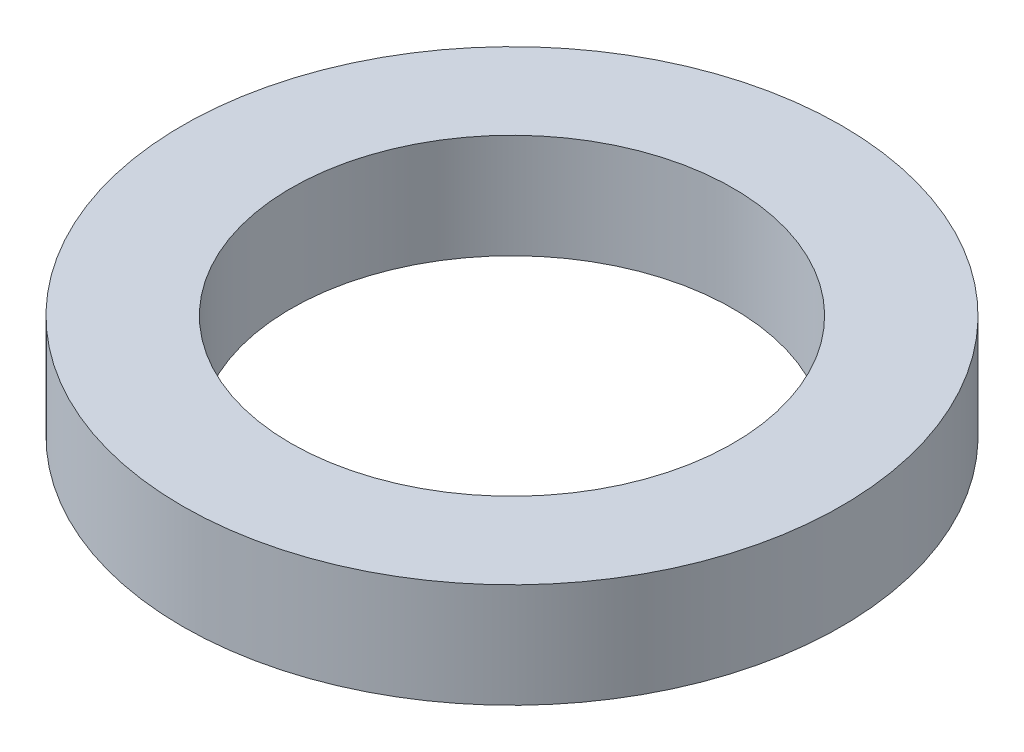
from build123d import *

# Parameters (mm, degrees)
SKETCH_1_W = 1.975
SKETCH_1_H = 1.9


with BuildPart() as part:
    # 草图1 → 旋转1 (revolve)
    with BuildSketch(Plane(origin=(0, 0, 0), x_dir=(-1, 0, 0), z_dir=(0, 0, -1)), mode=Mode.PRIVATE) as revolve_1_sk:
        with Locations((-5.0125, 0.95)):
            Rectangle(SKETCH_1_W, SKETCH_1_H)
    revolve(revolve_1_sk.sketch.rotate(Axis((0, 0, 0), (0, 1, 0)), 270), axis=Axis((0, 0, 0), (0, 1, 0)))


solid = part.part
